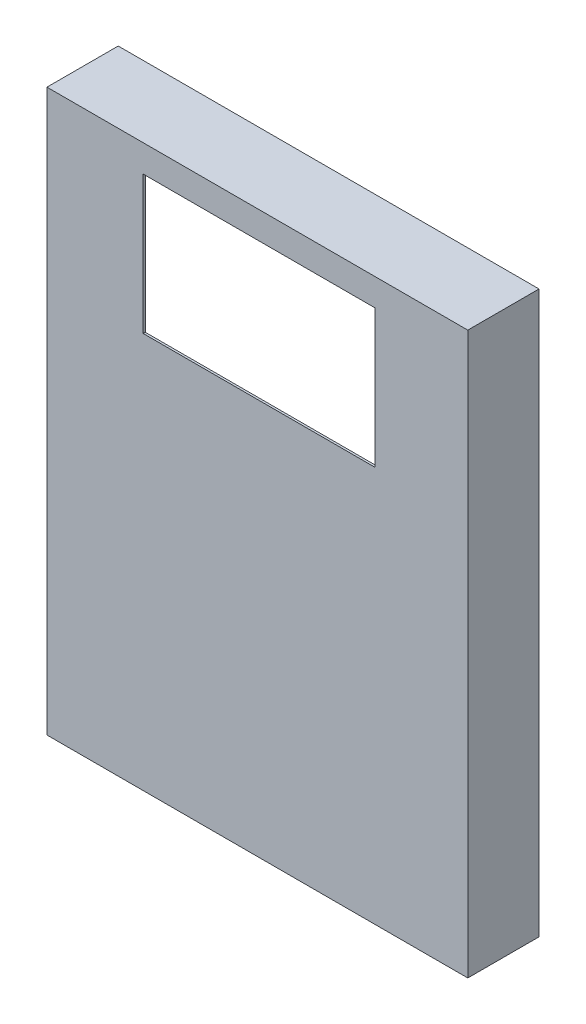
from build123d import *

# Parameters (mm, degrees)
SKETCH1_W           = 300
SKETCH1_H           = 400
BOSS_EXTRUDE1_DEPTH = 50.8
SHELL1_T            = -1.500000048
SKETCH2_W           = 165.1
SKETCH2_H           = 98.425
CUT_EXTRUDE1_DEPTH  = 256.109074711


with BuildPart() as part:
    # Sketch1 → Boss-Extrude1 (new body)
    with BuildSketch(Plane.XY):
        Rectangle(SKETCH1_W, SKETCH1_H)
    extrude(amount=BOSS_EXTRUDE1_DEPTH)

    # Shell1
    shell1_openings = [part.faces().sort_by_distance(p)[0] for p in [
        (0, 0, 0),
    ]]
    offset(amount=SHELL1_T, openings=shell1_openings, kind=Kind.INTERSECTION)

    # Sketch2 → Cut-Extrude1 (cut, through all)
    with BuildSketch(Plane.XY.offset(50.8)):
        with Locations((1.151083914, 131.430868262)):
            Rectangle(SKETCH2_W, SKETCH2_H)
    extrude(amount=-CUT_EXTRUDE1_DEPTH, mode=Mode.SUBTRACT)


solid = part.part
